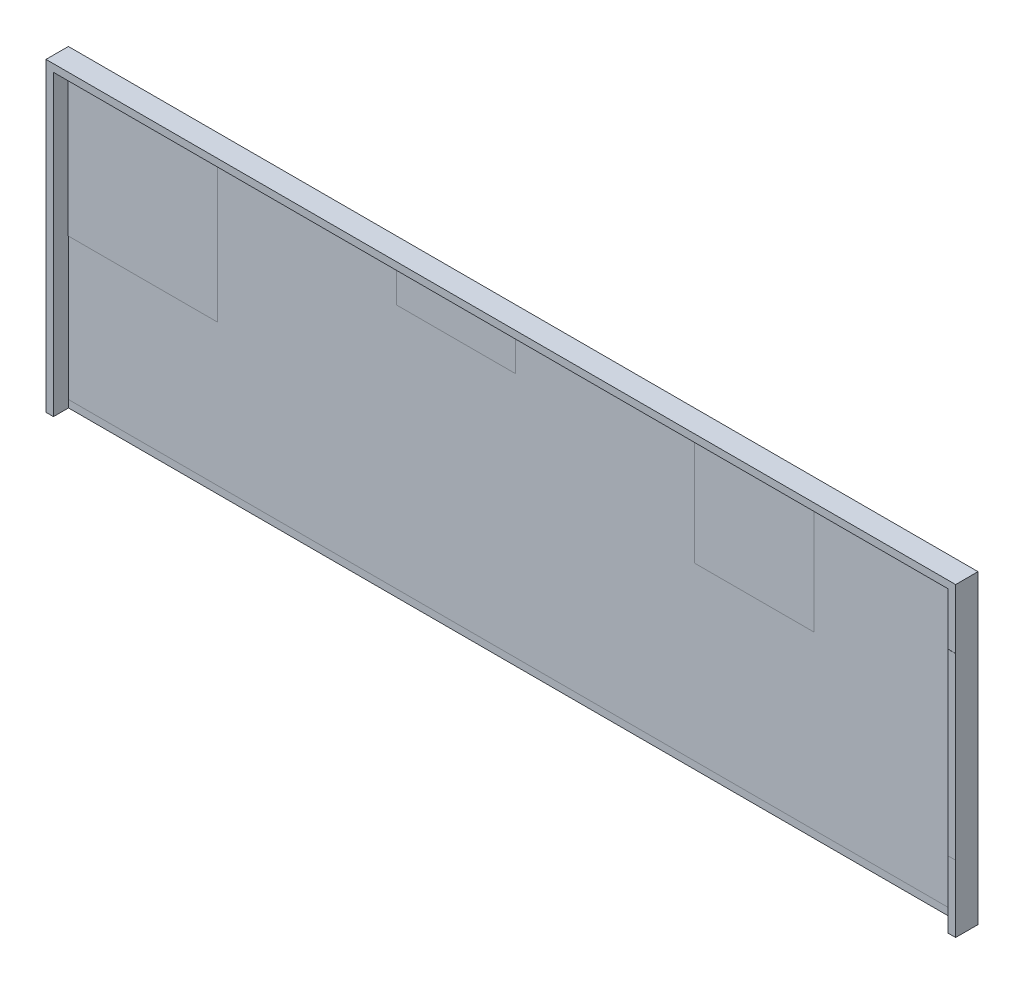
from build123d import *

# Parameters (mm, degrees)
SKETCH1_W           = 6100
SKETCH1_H           = 2050
BOSS_EXTRUDE1_DEPTH = 150
SHELL1_T            = -50
SKETCH2_W           = 1000
SKETCH2_H           = 1000
BOSS_EXTRUDE2_DEPTH = 1
SKETCH3_W           = 800
SKETCH3_H           = 800
BOSS_EXTRUDE3_DEPTH = 1
SKETCH4_W           = 800
SKETCH4_H           = 300
BOSS_EXTRUDE4_DEPTH = 1
SKETCH5_W           = 50
SKETCH5_H           = 1200
BOSS_EXTRUDE5_DEPTH = 1
SKETCH6_W           = 6000
SKETCH6_H           = 50
CUT_EXTRUDE1_DEPTH  = 101


with BuildPart() as part:
    # Sketch1 → Boss-Extrude1 (new body)
    with BuildSketch(Plane.XY):
        with Locations((617.567567568, 103.378378378)):
            Rectangle(SKETCH1_W, SKETCH1_H)
    extrude(amount=BOSS_EXTRUDE1_DEPTH)

    # Shell1
    shell1_openings = [part.faces().sort_by_distance(p)[0] for p in [
        (617.567567568, 103.378378378, 150),
    ]]
    offset(amount=SHELL1_T, openings=shell1_openings, kind=Kind.INTERSECTION)

    # Sketch2 → Boss-Extrude2 (add)
    with BuildSketch(Plane.XY.offset(50)):
        with Locations((-1882.432432432, 578.378378378)):
            Rectangle(SKETCH2_W, SKETCH2_H)
    extrude(amount=BOSS_EXTRUDE2_DEPTH)

    # Sketch3 → Boss-Extrude3 (add)
    with BuildSketch(Plane.XY.offset(50)):
        with Locations((2217.567567568, 678.378378378)):
            Rectangle(SKETCH3_W, SKETCH3_H)
    extrude(amount=BOSS_EXTRUDE3_DEPTH)

    # Sketch4 → Boss-Extrude4 (add)
    with BuildSketch(Plane.XY.offset(50)):
        with Locations((217.567567568, 928.378378378)):
            Rectangle(SKETCH4_W, SKETCH4_H)
    extrude(amount=BOSS_EXTRUDE4_DEPTH)

    # Sketch5 → Boss-Extrude5 (add)
    with BuildSketch(Plane.XY.offset(150)):
        with Locations((3642.567567568, 128.378378378)):
            Rectangle(SKETCH5_W, SKETCH5_H)
    extrude(amount=BOSS_EXTRUDE5_DEPTH)

    # Sketch6 → Cut-Extrude1 (cut)
    with BuildSketch(Plane.XY.offset(150)):
        with Locations((617.567567568, -896.621621622)):
            Rectangle(SKETCH6_W, SKETCH6_H)
    extrude(amount=-CUT_EXTRUDE1_DEPTH, mode=Mode.SUBTRACT)


solid = part.part
